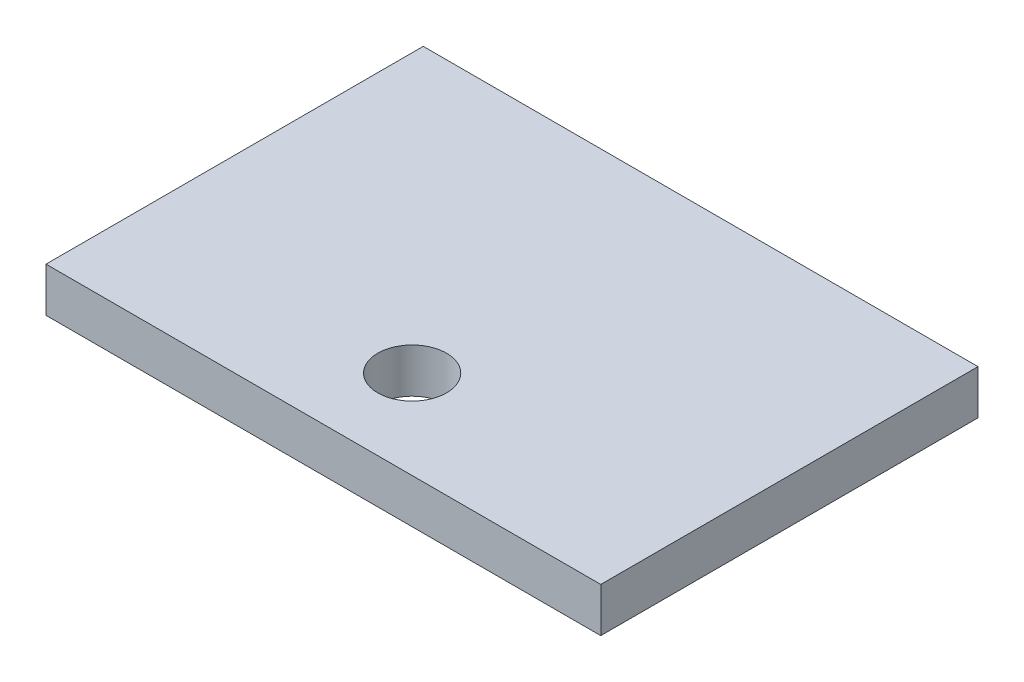
from build123d import *

# Parameters (mm, degrees)
SKETCH_1_W      = 25
SKETCH_1_H      = 17
SKETCH_1_R      = 1.55
EXTRUDE_1_DEPTH = 2


with BuildPart() as part:
    # 草图1 → 凸台-拉伸1 (new body)
    with BuildSketch(Plane(origin=(0, 0, 0), x_dir=(1, 0, 0), z_dir=(0, 1, 0))):
        Rectangle(SKETCH_1_W, SKETCH_1_H)
        with Locations(Location((0, -4.5, 0), (0, 0, 270))):
            Circle(SKETCH_1_R, mode=Mode.SUBTRACT)
    extrude(amount=EXTRUDE_1_DEPTH)


solid = part.part
